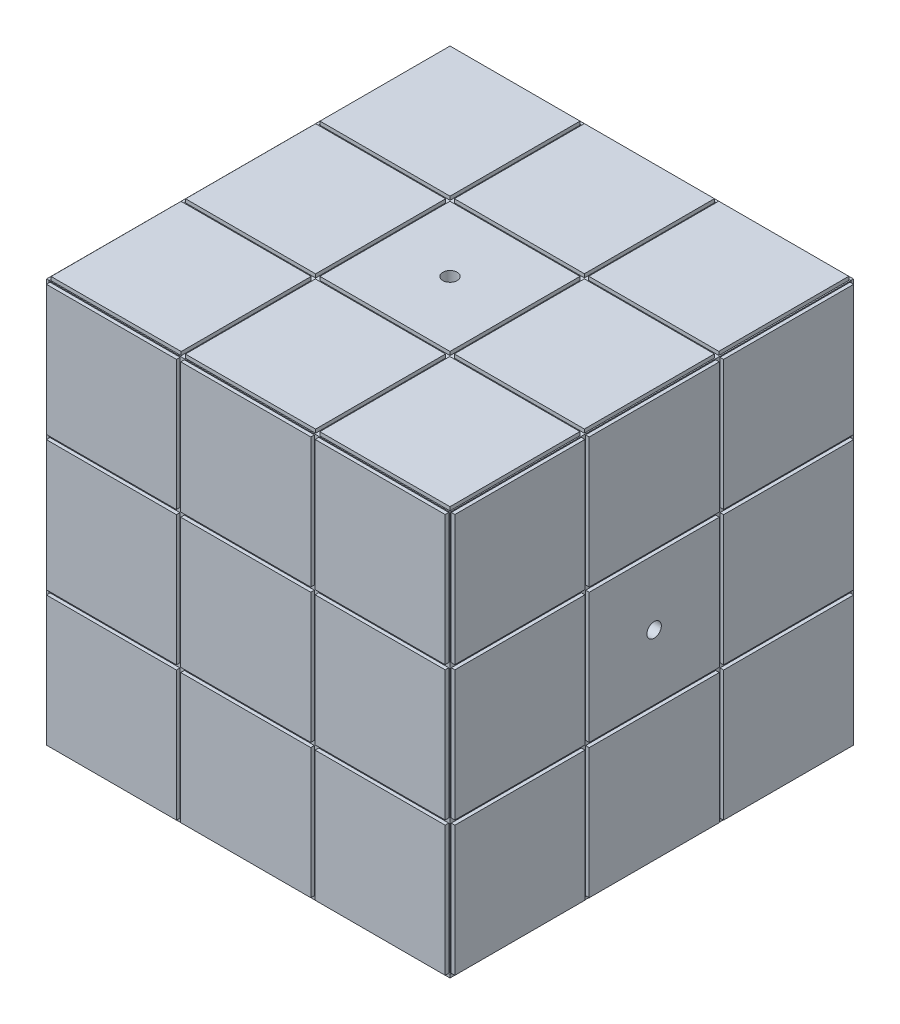
from build123d import *

# Parameters (mm, degrees)
SKETCH_1_W           = 56.5
SKETCH_1_H           = 56.5
EXTRUDE_1_DEPTH      = 56.5
SKETCH_2_OUTSIDE_W   = 78.072
SKETCH_2_OUTSIDE_H   = 78.072
SKETCH_2_OUTSIDE_W_2 = 18
SKETCH_2_OUTSIDE_H_2 = 18
CUT_EXTRUDE_1_DEPTH  = 0.5
SKETCH_3_W           = 56.5
SKETCH_3_H           = 56.5
SKETCH_3_W_2         = 18
SKETCH_3_H_2         = 18
CUT_EXTRUDE_2_DEPTH  = 0.5
SKETCH_4_OUTSIDE_W   = 78.072
SKETCH_4_OUTSIDE_H   = 78.072
SKETCH_4_OUTSIDE_W_2 = 18
SKETCH_4_OUTSIDE_H_2 = 18
CUT_EXTRUDE_3_DEPTH  = 0.5
SKETCH_5_OUTSIDE_W   = 78.072
SKETCH_5_OUTSIDE_H   = 78.072
SKETCH_5_OUTSIDE_W_2 = 18
SKETCH_5_OUTSIDE_H_2 = 18
CUT_EXTRUDE_4_DEPTH  = 0.5
SKETCH_6_OUTSIDE_W   = 78.072
SKETCH_6_OUTSIDE_H   = 78.072
SKETCH_6_OUTSIDE_W_2 = 18
SKETCH_6_OUTSIDE_H_2 = 18
CUT_EXTRUDE_5_DEPTH  = 0.5
SKETCH_7_W           = 55.5
SKETCH_7_H           = 55.5
SKETCH_7_W_2         = 18
SKETCH_7_H_2         = 18
CUT_EXTRUDE_6_DEPTH  = 0.5
SKETCH_8_R           = 1
CUT_EXTRUDE_7_DEPTH  = 10
SKETCH_9_R           = 1
CUT_EXTRUDE_8_DEPTH  = 10
SKETCH_10_R          = 1
CUT_EXTRUDE_9_DEPTH  = 10


with BuildPart() as part:
    # 草图1 → 凸台-拉伸1 (new body)
    with BuildSketch(Plane.XY):
        Rectangle(SKETCH_1_W, SKETCH_1_H)
    extrude(amount=EXTRUDE_1_DEPTH)

    # 草图2 outside → 切除-拉伸1 (cut)
    with BuildSketch(Plane.XY.offset(56.5)):
        Rectangle(SKETCH_2_OUTSIDE_W, SKETCH_2_OUTSIDE_H)
        with Locations((-18.625, 18.62)):
            Rectangle(SKETCH_2_OUTSIDE_W_2, SKETCH_2_OUTSIDE_H_2, mode=Mode.SUBTRACT)
        with Locations((-18.625, -18.62)):
            Rectangle(SKETCH_2_OUTSIDE_W_2, SKETCH_2_OUTSIDE_H_2, mode=Mode.SUBTRACT)
        with Locations((-0.025, 18.62)):
            Rectangle(SKETCH_2_OUTSIDE_W_2, SKETCH_2_OUTSIDE_H_2, mode=Mode.SUBTRACT)
        with Locations((-18.625, 0)):
            Rectangle(SKETCH_2_OUTSIDE_W_2, SKETCH_2_OUTSIDE_H_2, mode=Mode.SUBTRACT)
        with Locations((-0.025, 0)):
            Rectangle(SKETCH_2_OUTSIDE_W_2, SKETCH_2_OUTSIDE_H_2, mode=Mode.SUBTRACT)
        with Locations((-0.025, -18.62)):
            Rectangle(SKETCH_2_OUTSIDE_W_2, SKETCH_2_OUTSIDE_H_2, mode=Mode.SUBTRACT)
        with Locations((18.575, 18.62)):
            Rectangle(SKETCH_2_OUTSIDE_W_2, SKETCH_2_OUTSIDE_H_2, mode=Mode.SUBTRACT)
        with Locations((18.575, 0)):
            Rectangle(SKETCH_2_OUTSIDE_W_2, SKETCH_2_OUTSIDE_H_2, mode=Mode.SUBTRACT)
        with Locations((18.575, -18.62)):
            Rectangle(SKETCH_2_OUTSIDE_W_2, SKETCH_2_OUTSIDE_H_2, mode=Mode.SUBTRACT)
    extrude(amount=-CUT_EXTRUDE_1_DEPTH, mode=Mode.SUBTRACT)

    # 草图3 → 切除-拉伸2 (cut)
    with BuildSketch(Plane(origin=(0, 0, 0), x_dir=(-1, 0, 0), z_dir=(0, 0, -1))):
        Rectangle(SKETCH_3_W, SKETCH_3_H)
        with Locations((18.625, 18.62)):
            Rectangle(SKETCH_3_W_2, SKETCH_3_H_2, mode=Mode.SUBTRACT)
        with Locations((-18.575, 18.62)):
            Rectangle(SKETCH_3_W_2, SKETCH_3_H_2, mode=Mode.SUBTRACT)
        with Locations((0.025, 18.62)):
            Rectangle(SKETCH_3_W_2, SKETCH_3_H_2, mode=Mode.SUBTRACT)
        with Locations((-18.575, -18.62)):
            Rectangle(SKETCH_3_W_2, SKETCH_3_H_2, mode=Mode.SUBTRACT)
        with Locations((0.025, -18.62)):
            Rectangle(SKETCH_3_W_2, SKETCH_3_H_2, mode=Mode.SUBTRACT)
        with Locations((18.625, -18.62)):
            Rectangle(SKETCH_3_W_2, SKETCH_3_H_2, mode=Mode.SUBTRACT)
        with Locations((-18.575, 0)):
            Rectangle(SKETCH_3_W_2, SKETCH_3_H_2, mode=Mode.SUBTRACT)
        with Locations((0.025, 0)):
            Rectangle(SKETCH_3_W_2, SKETCH_3_H_2, mode=Mode.SUBTRACT)
        with Locations((18.625, 0)):
            Rectangle(SKETCH_3_W_2, SKETCH_3_H_2, mode=Mode.SUBTRACT)
    extrude(amount=-CUT_EXTRUDE_2_DEPTH, mode=Mode.SUBTRACT)

    # 草图4 outside → 切除-拉伸3 (cut)
    with BuildSketch(Plane.ZY.offset(28.25)):
        with Locations((28.25, 0)):
            Rectangle(SKETCH_4_OUTSIDE_W, SKETCH_4_OUTSIDE_H)
        with Locations((9.63, 18.62)):
            Rectangle(SKETCH_4_OUTSIDE_W_2, SKETCH_4_OUTSIDE_H_2, mode=Mode.SUBTRACT)
        with Locations((9.63, -18.62)):
            Rectangle(SKETCH_4_OUTSIDE_W_2, SKETCH_4_OUTSIDE_H_2, mode=Mode.SUBTRACT)
        with Locations((9.63, 0)):
            Rectangle(SKETCH_4_OUTSIDE_W_2, SKETCH_4_OUTSIDE_H_2, mode=Mode.SUBTRACT)
        with Locations((28.23, 18.62)):
            Rectangle(SKETCH_4_OUTSIDE_W_2, SKETCH_4_OUTSIDE_H_2, mode=Mode.SUBTRACT)
        with Locations((28.23, 0)):
            Rectangle(SKETCH_4_OUTSIDE_W_2, SKETCH_4_OUTSIDE_H_2, mode=Mode.SUBTRACT)
        with Locations((28.23, -18.62)):
            Rectangle(SKETCH_4_OUTSIDE_W_2, SKETCH_4_OUTSIDE_H_2, mode=Mode.SUBTRACT)
        with Locations((46.83, 18.62)):
            Rectangle(SKETCH_4_OUTSIDE_W_2, SKETCH_4_OUTSIDE_H_2, mode=Mode.SUBTRACT)
        with Locations((46.83, 0)):
            Rectangle(SKETCH_4_OUTSIDE_W_2, SKETCH_4_OUTSIDE_H_2, mode=Mode.SUBTRACT)
        with Locations((46.83, -18.62)):
            Rectangle(SKETCH_4_OUTSIDE_W_2, SKETCH_4_OUTSIDE_H_2, mode=Mode.SUBTRACT)
    extrude(amount=-CUT_EXTRUDE_3_DEPTH, mode=Mode.SUBTRACT)

    # 草图5 outside → 切除-拉伸4 (cut)
    with BuildSketch(Plane(origin=(28.25, 0, 0), x_dir=(0, 0, -1), z_dir=(1, 0, 0))):
        with Locations((-28.25, 0)):
            Rectangle(SKETCH_5_OUTSIDE_W, SKETCH_5_OUTSIDE_H)
        with Locations((-9.63, 18.62)):
            Rectangle(SKETCH_5_OUTSIDE_W_2, SKETCH_5_OUTSIDE_H_2, mode=Mode.SUBTRACT)
        with Locations((-46.83, -18.62)):
            Rectangle(SKETCH_5_OUTSIDE_W_2, SKETCH_5_OUTSIDE_H_2, mode=Mode.SUBTRACT)
        with Locations((-28.23, -18.62)):
            Rectangle(SKETCH_5_OUTSIDE_W_2, SKETCH_5_OUTSIDE_H_2, mode=Mode.SUBTRACT)
        with Locations((-9.63, -18.62)):
            Rectangle(SKETCH_5_OUTSIDE_W_2, SKETCH_5_OUTSIDE_H_2, mode=Mode.SUBTRACT)
        with Locations((-46.83, 0)):
            Rectangle(SKETCH_5_OUTSIDE_W_2, SKETCH_5_OUTSIDE_H_2, mode=Mode.SUBTRACT)
        with Locations((-28.23, 0)):
            Rectangle(SKETCH_5_OUTSIDE_W_2, SKETCH_5_OUTSIDE_H_2, mode=Mode.SUBTRACT)
        with Locations((-9.63, 0)):
            Rectangle(SKETCH_5_OUTSIDE_W_2, SKETCH_5_OUTSIDE_H_2, mode=Mode.SUBTRACT)
        with Locations((-46.83, 18.62)):
            Rectangle(SKETCH_5_OUTSIDE_W_2, SKETCH_5_OUTSIDE_H_2, mode=Mode.SUBTRACT)
        with Locations((-28.23, 18.62)):
            Rectangle(SKETCH_5_OUTSIDE_W_2, SKETCH_5_OUTSIDE_H_2, mode=Mode.SUBTRACT)
    extrude(amount=-CUT_EXTRUDE_4_DEPTH, mode=Mode.SUBTRACT)

    # 草图6 outside → 切除-拉伸5 (cut)
    with BuildSketch(Plane(origin=(0, 28.25, 0), x_dir=(1, 0, 0), z_dir=(0, 1, 0))):
        with Locations((0, -28.25)):
            Rectangle(SKETCH_6_OUTSIDE_W, SKETCH_6_OUTSIDE_H)
        with Locations((-18.62, -9.63)):
            Rectangle(SKETCH_6_OUTSIDE_W_2, SKETCH_6_OUTSIDE_H_2, mode=Mode.SUBTRACT)
        Polygon((-27.613128605, -37.869904689), (-27.600271464, -55.869900097), (-9.600276056, -55.857042956), (-9.613133197, -37.857047548), align=None, mode=Mode.SUBTRACT)
        with Locations((-0.02, -9.63)):
            Rectangle(SKETCH_6_OUTSIDE_W_2, SKETCH_6_OUTSIDE_H_2, mode=Mode.SUBTRACT)
        with Locations((-18.61013688, -28.246735763)):
            Rectangle(SKETCH_6_OUTSIDE_W_2, SKETCH_6_OUTSIDE_H_2, mode=Mode.SUBTRACT)
        with Locations((-0.01013688, -28.246735763)):
            Rectangle(SKETCH_6_OUTSIDE_W_2, SKETCH_6_OUTSIDE_H_2, mode=Mode.SUBTRACT)
        Polygon((8.986866803, -37.857047548), (-9.013128605, -37.869904689), (-9.000271464, -55.869900097), (8.999723944, -55.857042956), align=None, mode=Mode.SUBTRACT)
        with Locations((18.58, -9.63)):
            Rectangle(SKETCH_6_OUTSIDE_W_2, SKETCH_6_OUTSIDE_H_2, mode=Mode.SUBTRACT)
        with Locations((18.58986312, -28.246735763)):
            Rectangle(SKETCH_6_OUTSIDE_W_2, SKETCH_6_OUTSIDE_H_2, mode=Mode.SUBTRACT)
        Polygon((27.586866803, -37.857047548), (9.586871395, -37.869904689), (9.599728536, -55.869900097), (27.599723944, -55.857042956), align=None, mode=Mode.SUBTRACT)
    extrude(amount=-CUT_EXTRUDE_5_DEPTH, mode=Mode.SUBTRACT)

    # 草图7 → 切除-拉伸6 (cut)
    with BuildSketch(Plane.XZ.offset(28.25)):
        with Locations((0, 28.25)):
            Rectangle(SKETCH_7_W, SKETCH_7_H)
        with Locations((-18.62, 9.63)):
            Rectangle(SKETCH_7_W_2, SKETCH_7_H_2, mode=Mode.SUBTRACT)
        Polygon((9.599728536, 55.869900097), (27.599723944, 55.857042956), (27.586866803, 37.857047548), (9.586871395, 37.869904689), align=None, mode=Mode.SUBTRACT)
        Polygon((-9.000271464, 55.869900097), (8.999723944, 55.857042956), (8.986866803, 37.857047548), (-9.013128605, 37.869904689), align=None, mode=Mode.SUBTRACT)
        Polygon((-9.600276056, 55.857042956), (-9.613133197, 37.857047548), (-27.613128605, 37.869904689), (-27.600271464, 55.869900097), align=None, mode=Mode.SUBTRACT)
        with Locations((18.58986312, 28.246735763)):
            Rectangle(SKETCH_7_W_2, SKETCH_7_H_2, mode=Mode.SUBTRACT)
        with Locations((-0.01013688, 28.246735763)):
            Rectangle(SKETCH_7_W_2, SKETCH_7_H_2, mode=Mode.SUBTRACT)
        with Locations((-18.61013688, 28.246735763)):
            Rectangle(SKETCH_7_W_2, SKETCH_7_H_2, mode=Mode.SUBTRACT)
        with Locations((18.58, 9.63)):
            Rectangle(SKETCH_7_W_2, SKETCH_7_H_2, mode=Mode.SUBTRACT)
        with Locations((-0.02, 9.63)):
            Rectangle(SKETCH_7_W_2, SKETCH_7_H_2, mode=Mode.SUBTRACT)
    extrude(amount=-CUT_EXTRUDE_6_DEPTH, mode=Mode.SUBTRACT)

    # 草图8 → 切除-拉伸7 (cut)
    with BuildSketch(Plane(origin=(28.25, 0, 0), x_dir=(0, 0, -1), z_dir=(1, 0, 0))):
        with Locations(Location((-28.25, 1.89e-07, 0), (0, 0, 90))):
            Circle(SKETCH_8_R)
    extrude(amount=-CUT_EXTRUDE_7_DEPTH, mode=Mode.SUBTRACT)

    # 草图9 → 切除-拉伸8 (cut)
    with BuildSketch(Plane(origin=(0, 0, 0), x_dir=(-1, 0, 0), z_dir=(0, 0, -1))):
        Circle(SKETCH_9_R)
    extrude(amount=-CUT_EXTRUDE_8_DEPTH, mode=Mode.SUBTRACT)

    # 草图10 → 切除-拉伸9 (cut)
    with BuildSketch(Plane(origin=(0, 28.25, 0), x_dir=(1, 0, 0), z_dir=(0, 1, 0))):
        with Locations(Location((0, -28.25, 0), (0, 0, 270))):
            Circle(SKETCH_10_R)
    extrude(amount=-CUT_EXTRUDE_9_DEPTH, mode=Mode.SUBTRACT)


solid = part.part
